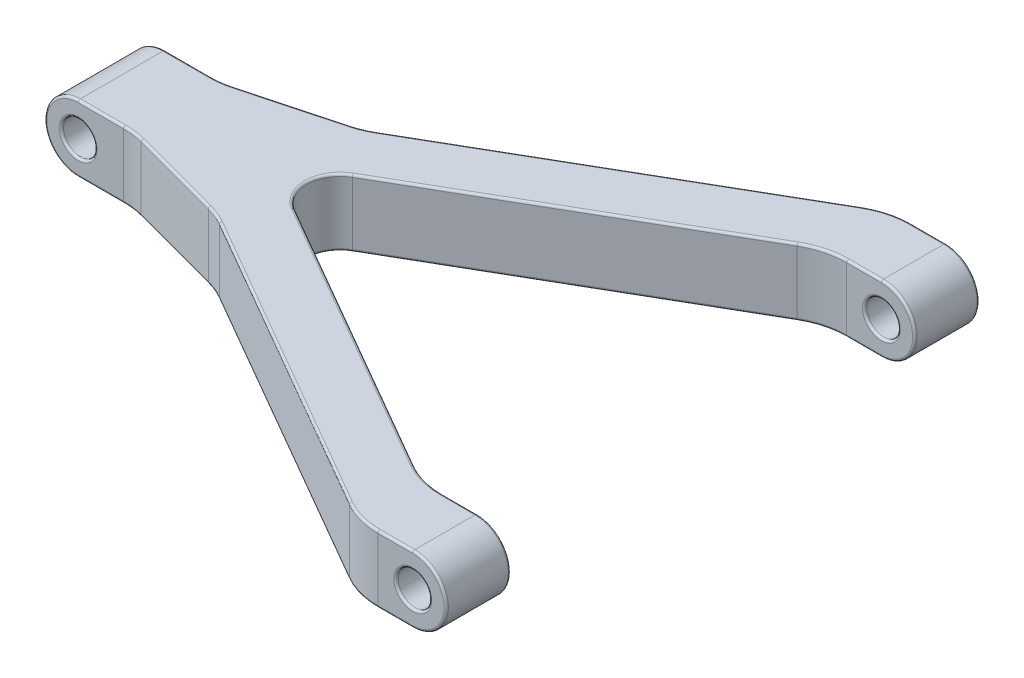
from build123d import *

# Parameters (mm, degrees)
BOSS_EXTRUDE1_DEPTH     = 60
SKETCH2_R               = 30
BOSS_EXTRUDE2_DEPTH     = 78
SKETCH3_R               = 15
CUT_EXTRUDE1_DEPTH      = 78
SKETCH4_R               = 30
BOSS_EXTRUDE3_DEPTH     = 57.74
BOSS_EXTRUDE4_START     = -57.74
SKETCH5_R               = 30
BOSS_EXTRUDE4_DEPTH     = 57.74
CUT_EXTRUDE2_DEPTH      = 588.619530081
CUT_EXTRUDE2_DEPTH_BACK = 588.619530081
SKETCH7_R               = 15
FILLET1_R               = 70
FILLET2_R               = 2


with BuildPart() as part:
    # Sketch1 → Boss-Extrude1 (new body)
    with BuildSketch(Plane(origin=(0, 0, 0), x_dir=(1, 0, 0), z_dir=(0, 1, 0))):
        with BuildLine():
            Line((-193.529032258, -39), (-193.529032258, 39))
            Line((-193.529032258, 39), (-143.529032258, 39))
            Line((-143.529032258, 39), (-43.529032258, 65.794919243))
            Line((-43.529032258, 65.794919243), (256.470967742, 239))
            Line((256.470967742, 239), (306.470967742, 239))
            Line((306.470967742, 239), (306.470967742, 181.26))
            Line((306.470967742, 181.26), (256.462354113, 181.26))
            Line((256.462354113, 181.26), (-12.489175267, 25.980762114))
            ThreePointArc((-12.489175267, 25.980762114), (-27.489175267, 0), (-12.489175267, -25.980762114))
            Line((-12.489175267, -25.980762114), (256.462354113, -181.26))
            Line((256.462354113, -181.26), (306.470967742, -181.26))
            Line((306.470967742, -181.26), (306.470967742, -239))
            Line((306.470967742, -239), (256.470967742, -239))
            Line((256.470967742, -239), (-43.529032258, -65.794919243))
            Line((-43.529032258, -65.794919243), (-143.529032258, -39))
            Line((-143.529032258, -39), (-193.529032258, -39))
        make_face()
    extrude(amount=BOSS_EXTRUDE1_DEPTH)

    # Sketch2 → Boss-Extrude2 (add)
    with BuildSketch(Plane.XY.offset(39)):
        with Locations((-193.529032258, 30)):
            Circle(SKETCH2_R)
    extrude(amount=-BOSS_EXTRUDE2_DEPTH)

    # Sketch3 → Cut-Extrude1 (cut)
    with BuildSketch(Plane.XY.offset(39)):
        with Locations((-193.529032258, 30)):
            Circle(SKETCH3_R)
    extrude(amount=-CUT_EXTRUDE1_DEPTH, mode=Mode.SUBTRACT)

    # Sketch4 → Boss-Extrude3 (add)
    with BuildSketch(Plane(origin=(0, 0, -239), x_dir=(-1, 0, 0), z_dir=(0, 0, -1))):
        with Locations((-306.470967742, 30)):
            Circle(SKETCH4_R)
    extrude(amount=-BOSS_EXTRUDE3_DEPTH)

    # Sketch5 → Boss-Extrude4 (add)
    with BuildSketch(Plane.XY.offset(239).offset(BOSS_EXTRUDE4_START)):
        with Locations((306.470967742, 30)):
            Circle(SKETCH5_R)
    extrude(amount=BOSS_EXTRUDE4_DEPTH)

    # Sketch7 → Cut-Extrude2 (cut, two sides: drawn at the far end of the back side and taken through both)
    with BuildSketch(Plane(origin=(0, 0, -239), x_dir=(-1, 0, 0), z_dir=(0, 0, -1)).offset(-CUT_EXTRUDE2_DEPTH_BACK)):
        with Locations((-306.470967742, 30)):
            Circle(SKETCH7_R)
    extrude(amount=CUT_EXTRUDE2_DEPTH + CUT_EXTRUDE2_DEPTH_BACK, mode=Mode.SUBTRACT)

    # Fillet1
    fillet1_edges = [part.edges().sort_by_distance(p)[0] for p in [
        (256.462354113, 30, -181.26),
        (256.462354113, 30, 181.26),
        (256.470967742, 30, 239),
        (-43.529032258, 30, 65.794919243),
        (-143.529032258, 30, 39),
        (-143.529032258, 30, -39),
        (-43.529032258, 30, -65.794919243),
        (256.470967742, 30, -239),
    ]]
    fillet(fillet1_edges, radius=FILLET1_R)

    # Fillet2
    fillet2_edges = [part.edges().sort_by_distance(p)[0] for p in [
        (290.844882663, 60, -181.26),
        (102.339693735, 60, -150.012267462),
        (113.864811158, 60, 98.931270189),
        (257.110078055, 60, -236.61480784),
        (257.110078055, 60, 236.61480784),
        (-143.607873634, 0, -39.598859704),
        (-143.607873634, 60, -39.598859704),
        (-143.607873634, 0, 39.598859704),
        (-143.607873634, 60, 39.598859704),
        (-43.760183476, 0, 66.352967648),
        (-43.760183476, 60, 66.352967648),
        (257.101464426, 0, 178.87480784),
        (257.101464426, 60, 178.87480784),
        (257.101464426, 0, -178.87480784),
        (257.101464426, 60, -178.87480784),
        (-43.760183476, 0, -66.352967648),
        (-43.760183476, 60, -66.352967648),
        (290.849189477, 60, -239),
        (113.864811158, 0, -98.931270189),
        (-27.489175267, 0, 0),
        (290.844882663, 0, 181.26),
        (-173.136869674, 0, 39),
        (290.849189477, 0, -239),
        (-173.136869674, 60, 39),
        (-223.529032258, 30, 39),
        (-223.529032258, 30, -39),
        (290.844882663, 60, 181.26),
        (-208.529032258, 30, 39),
        (-208.529032258, 30, -39),
        (336.470967742, 30, -239),
        (-27.489175267, 60, 0),
        (336.470967742, 30, -181.26),
        (113.864811158, 60, -98.931270189),
        (336.470967742, 30, 239),
        (336.470967742, 30, 181.26),
        (321.470967742, 30, -239),
        (321.470967742, 30, -181.26),
        (321.470967742, 30, 239),
        (321.470967742, 30, 181.26),
        (-173.136869674, 0, -39),
        (-173.136869674, 60, -39),
        (-93.529032258, 0, -52.397459622),
        (-93.529032258, 60, -52.397459622),
        (-93.529032258, 0, 52.397459622),
        (-93.529032258, 60, 52.397459622),
        (290.849189477, 0, 239),
        (290.849189477, 60, 239),
        (290.844882663, 0, -181.26),
        (113.864811158, 0, 98.931270189),
        (102.339693735, 0, 150.012267462),
        (102.339693735, 0, -150.012267462),
        (257.110078055, 0, -236.61480784),
        (257.110078055, 0, 236.61480784),
        (102.339693735, 60, 150.012267462),
    ]]
    fillet(fillet2_edges, radius=FILLET2_R)


solid = part.part
